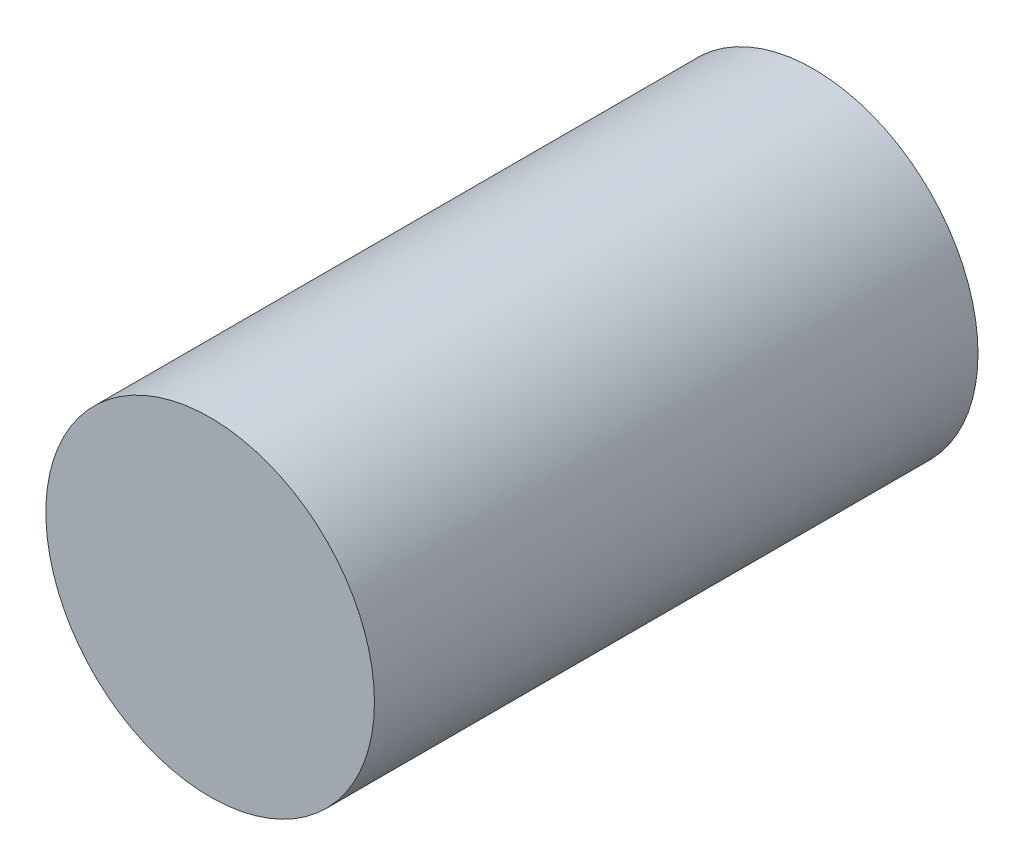
from build123d import *

# Parameters (mm, degrees)
SKETCH1_R           = 2.45
BOSS_EXTRUDE1_DEPTH = 9


with BuildPart() as part:
    # Sketch1 → Boss-Extrude1 (new body)
    with BuildSketch(Plane.XY):
        Circle(SKETCH1_R)
    extrude(amount=BOSS_EXTRUDE1_DEPTH)


solid = part.part
